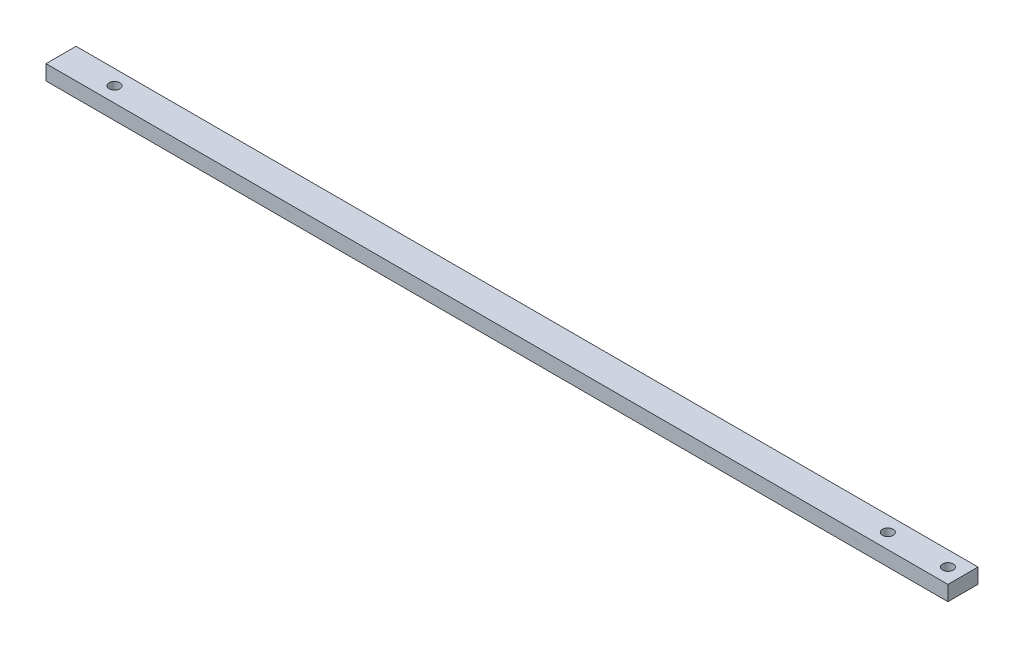
from build123d import *

# Parameters (mm, degrees)
SKETCH1_W           = 381
SKETCH1_H           = 12.7
SKETCH1_R           = 2.2479
BOSS_EXTRUDE2_DEPTH = 6.35


with BuildPart() as part:
    # Sketch1 → Boss-Extrude2 (new body)
    with BuildSketch(Plane(origin=(0, 0, 0), x_dir=(1, 0, 0), z_dir=(0, 1, 0))):
        with Locations((190.5, 6.35)):
            Rectangle(SKETCH1_W, SKETCH1_H)
        with Locations(Location((22.5679, 6.35, 0), (0, 0, 270))):
            Circle(SKETCH1_R, mode=Mode.SUBTRACT)
        with Locations(Location((349.25, 6.35, 0), (0, 0, 270))):
            Circle(SKETCH1_R, mode=Mode.SUBTRACT)
        with Locations(Location((374.65, 6.35, 0), (0, 0, 270))):
            Circle(SKETCH1_R, mode=Mode.SUBTRACT)
    extrude(amount=BOSS_EXTRUDE2_DEPTH)


solid = part.part
